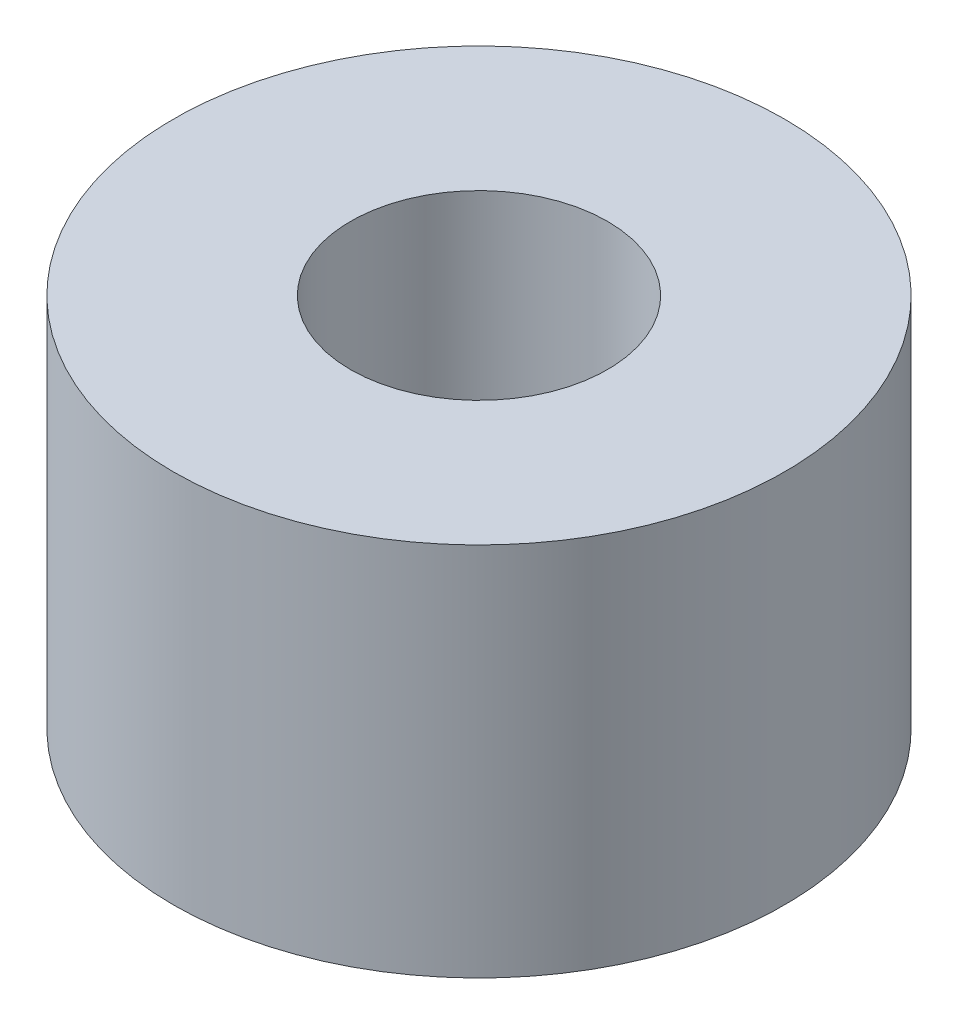
from build123d import *

# Parameters (mm, degrees)
SKETCH1_R           = 55.88
SKETCH1_R_2         = 23.495
BOSS_EXTRUDE1_DEPTH = 68.58


with BuildPart() as part:
    # Sketch1 → Boss-Extrude1 (new body)
    with BuildSketch(Plane(origin=(0, 0, 0), x_dir=(1, 0, 0), z_dir=(0, 1, 0))):
        with Locations(Location((0, 0, 0), (0, 0, 270))):
            Circle(SKETCH1_R)
        with Locations(Location((0, 0, 0), (0, 0, 270))):
            Circle(SKETCH1_R_2, mode=Mode.SUBTRACT)
    extrude(amount=BOSS_EXTRUDE1_DEPTH)


solid = part.part
